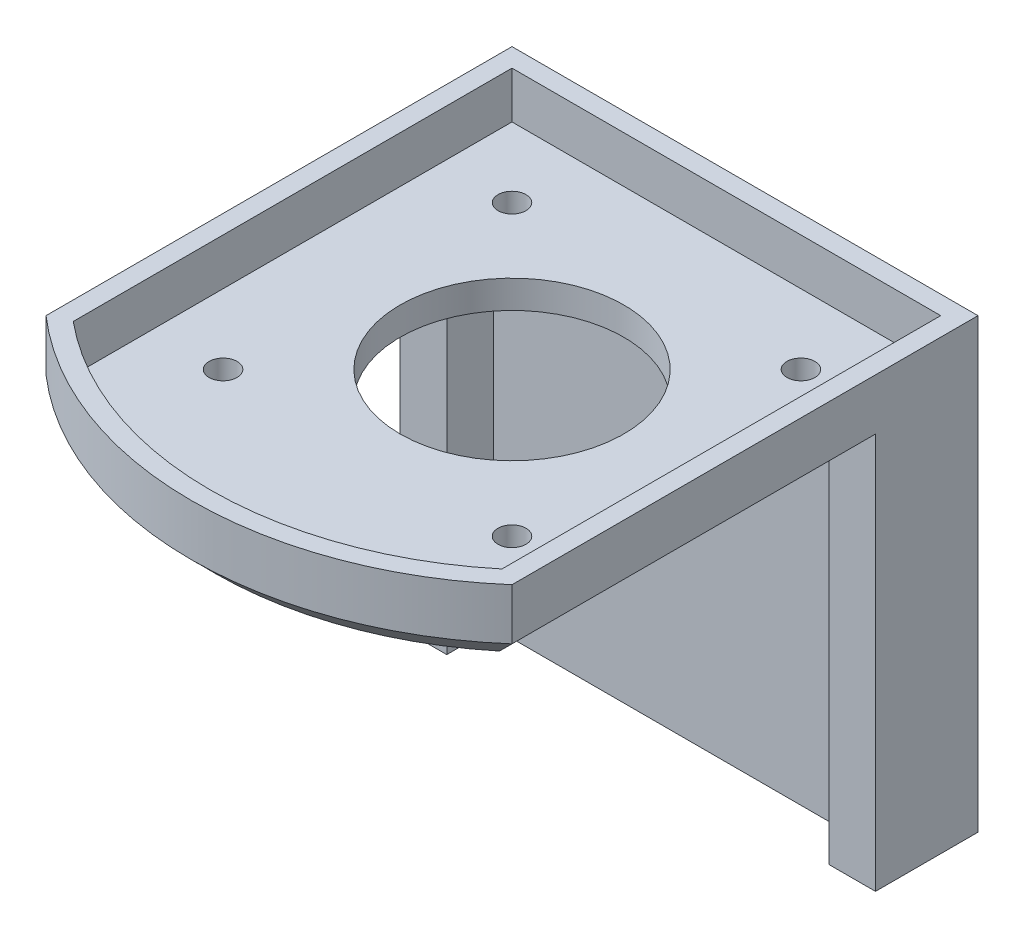
from build123d import *

# Parameters (mm, degrees)
EXTRUDE_1_DEPTH      = 3
SKETCH_28_R          = 12
SKETCH_28_R_2        = 1.5
CUT_EXTRUDE_9_DEPTH  = 4
EXTRUDE_11_DEPTH     = 5
EXTRUDE_14_DEPTH     = 40
CUT_EXTRUDE_12_DEPTH = 4
SKETCH_34_R          = 1.5
CUT_EXTRUDE_13_DEPTH = 4
CHAMFER_1_SIZE       = 2.5
CHAMFER_2_SIZE       = 2.5
CHAMFER_3_SIZE       = 2.5


with BuildPart() as part:
    # 草图1 → 凸台-拉伸1 (new body)
    with BuildSketch(Plane(origin=(0, 0, 0), x_dir=(1, 0, 0), z_dir=(0, 1, 0))):
        with BuildLine():
            Line((-25, 21.381823957), (-25, -28.618176043))
            ThreePointArc((-25, -28.618176043), (0, -38), (25, -28.618176043))
            Line((25, -28.618176043), (25, 21.381823957))
            Line((25, 21.381823957), (-25, 21.381823957))
        make_face()
    extrude(amount=EXTRUDE_1_DEPTH)

    # 草图28 → 切除-拉伸9 (cut)
    with BuildSketch(Plane(origin=(0, 3, 0), x_dir=(1, 0, 0), z_dir=(0, 1, 0))):
        with Locations(Location((0, -3.618176043, 0), (0, 0, 270))):
            Circle(SKETCH_28_R)
        with Locations(Location((-15.5, 11.881823957, 0), (0, 0, 270))):
            Circle(SKETCH_28_R_2)
        with Locations(Location((-15.5, -19.118176043, 0), (0, 0, 270))):
            Circle(SKETCH_28_R_2)
        with Locations(Location((15.5, 11.881823957, 0), (0, 0, 270))):
            Circle(SKETCH_28_R_2)
        with Locations(Location((15.5, -19.118176043, 0), (0, 0, 270))):
            Circle(SKETCH_28_R_2)
    extrude(amount=-CUT_EXTRUDE_9_DEPTH, mode=Mode.SUBTRACT)

    # 草图30 → 凸台-拉伸11 (add)
    with BuildSketch(Plane(origin=(0, 3, 0), x_dir=(1, 0, 0), z_dir=(0, 1, 0))):
        with BuildLine():
            ThreePointArc((-25, -28.618176043), (0, -38), (25, -28.618176043))
            Line((25, -28.618176043), (25, 21.381823957))
            Line((25, 21.381823957), (-25, 21.381823957))
            Line((-25, 21.381823957), (-25, -28.618176043))
        make_face()
        with BuildLine():
            ThreePointArc((23, -27.694764848), (0, -36), (-23, -27.694764848))
            Line((-23, -27.694764848), (-23, 19.381823957))
            Line((-23, 19.381823957), (23, 19.381823957))
            Line((23, 19.381823957), (23, -27.694764848))
        make_face(mode=Mode.SUBTRACT)
    extrude(amount=EXTRUDE_11_DEPTH)

    # 草图32 → 凸台-拉伸14 (add)
    with BuildSketch(Plane.XZ):
        Polygon((-25, -21.381823957), (-25, -9.381823957), (-20, -9.381823957), (-20, -14.381823957), (20, -14.381823957), (20, -10.381823957), (25, -10.381823957), (25, -21.381823957), align=None)
    extrude(amount=EXTRUDE_14_DEPTH)

    # 草图33 → 切除-拉伸12 (cut)
    with BuildSketch(Plane(origin=(0, 0, -21.381823957), x_dir=(-1, 0, 0), z_dir=(0, 0, -1))):
        Polygon((0, -20.330127019), (0, -11.669872981), (-2.5, -11.669872981), (-5, -16), (-2.5, -20.330127019), align=None)
        Polygon((2.5, -11.669872981), (0, -11.669872981), (0, -20.330127019), (2.5, -20.330127019), (5, -16), align=None)
    extrude(amount=-CUT_EXTRUDE_12_DEPTH, mode=Mode.SUBTRACT)

    # 草图34 → 切除-拉伸13 (cut)
    with BuildSketch(Plane(origin=(0, 0, -17.381823957), x_dir=(-1, 0, 0), z_dir=(0, 0, -1))):
        with Locations((0, -16)):
            Circle(SKETCH_34_R)
    extrude(amount=-CUT_EXTRUDE_13_DEPTH, mode=Mode.SUBTRACT)

    # 倒角1
    chamfer_1_edges = [part.edges().sort_by_distance(p)[0] for p in [
        (25, 0, 9.118176043),
    ]]
    chamfer(chamfer_1_edges, length=CHAMFER_1_SIZE)

    # 倒角2
    chamfer_2_edges = [part.edges().sort_by_distance(p)[0] for p in [
        (-25, 0, 9.618176043),
    ]]
    chamfer(chamfer_2_edges, length=CHAMFER_2_SIZE)

    # 倒角3
    chamfer_3_edges = [part.edges().sort_by_distance(p)[0] for p in [
        (0, 0, 38),
    ]]
    chamfer(chamfer_3_edges, length=CHAMFER_3_SIZE)


solid = part.part
